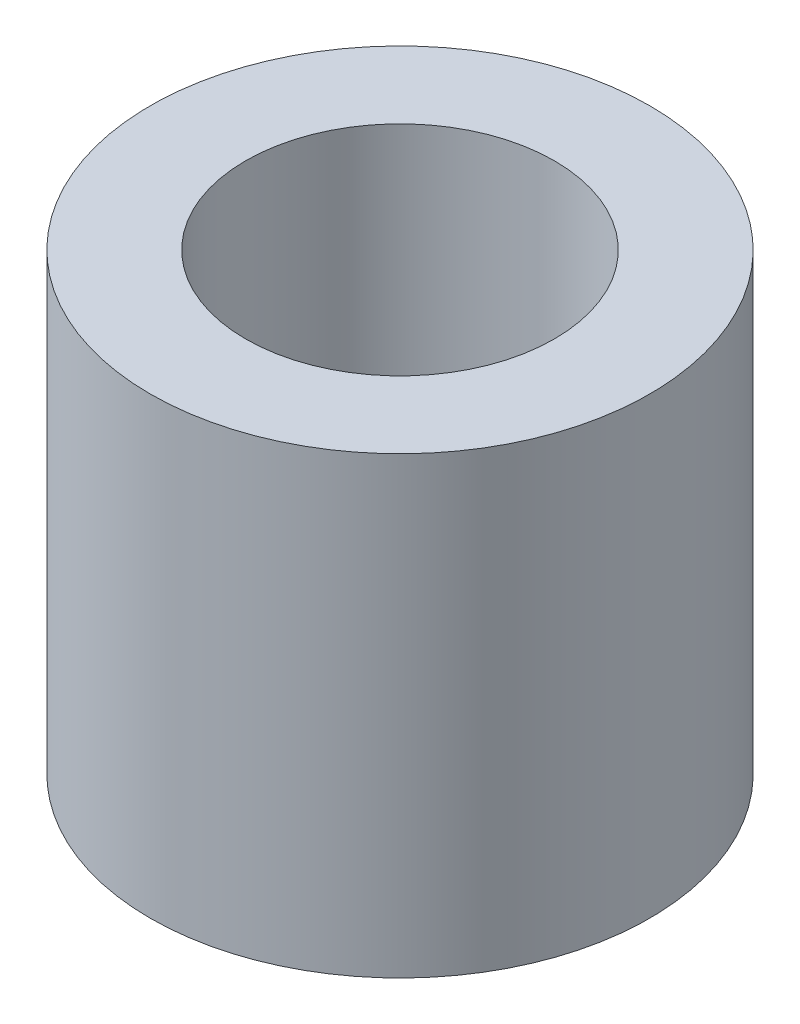
from build123d import *

# Parameters (mm, degrees)
SKETCH1_R           = 2.75
SKETCH1_R_2         = 1.7
BOSS_EXTRUDE1_DEPTH = 5


with BuildPart() as part:
    # Sketch1 → Boss-Extrude1 (new body)
    with BuildSketch(Plane(origin=(0, 0, 0), x_dir=(1, 0, 0), z_dir=(0, 1, 0))):
        with Locations(Location((0, 0, 0), (0, 0, 270))):
            Circle(SKETCH1_R)
        with Locations(Location((0, 0, 0), (0, 0, 270))):
            Circle(SKETCH1_R_2, mode=Mode.SUBTRACT)
    extrude(amount=BOSS_EXTRUDE1_DEPTH)


solid = part.part
